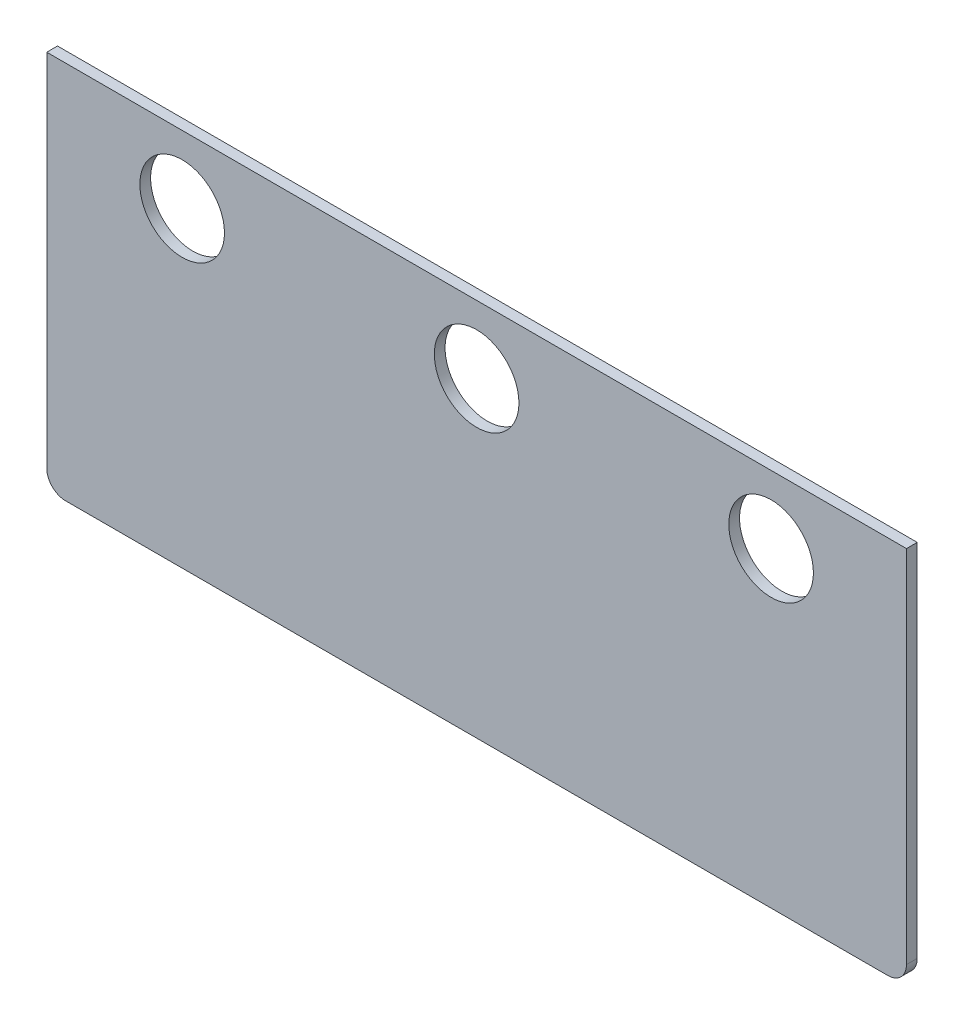
from build123d import *

# Parameters (mm, degrees)
SKETCH1_W           = 254
SKETCH1_H           = 112
SKETCH1_R           = 12.5
BOSS_EXTRUDE1_DEPTH = 3.175
FILLET1_R           = 5.55625


with BuildPart() as part:
    # Sketch1 → Boss-Extrude1 (new body)
    with BuildSketch(Plane.XY):
        with Locations((0, 56)):
            Rectangle(SKETCH1_W, SKETCH1_H)
        with Locations((87, 92)):
            Circle(SKETCH1_R, mode=Mode.SUBTRACT)
        with Locations((0, 92)):
            Circle(SKETCH1_R, mode=Mode.SUBTRACT)
        with Locations((-87, 92)):
            Circle(SKETCH1_R, mode=Mode.SUBTRACT)
    extrude(amount=BOSS_EXTRUDE1_DEPTH)

    # Fillet1
    fillet1_edges = [part.edges().sort_by_distance(p)[0] for p in [
        (127, 0, 1.5875),
        (-127, 0, 1.5875),
    ]]
    fillet(fillet1_edges, radius=FILLET1_R)


solid = part.part
